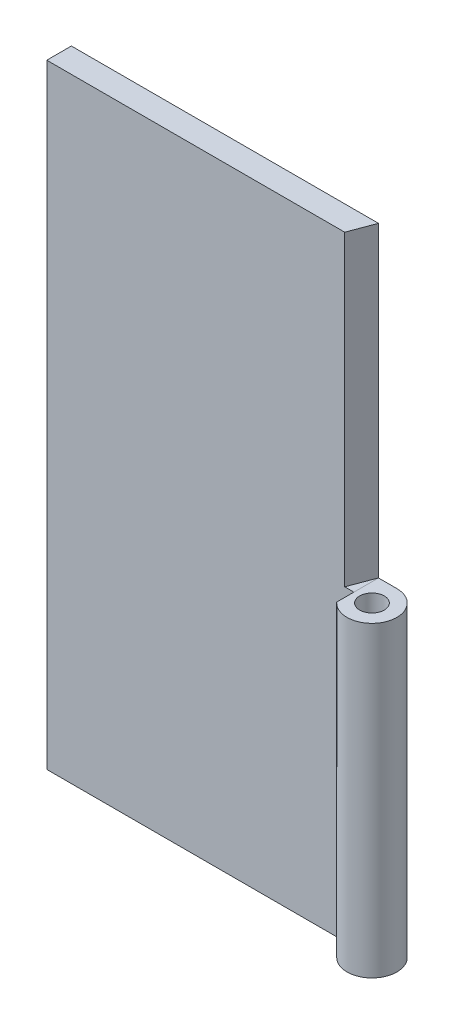
from build123d import *

# Parameters (mm, degrees)
SKETCH1_W           = 25
SKETCH1_H           = 50
BOSS_EXTRUDE1_DEPTH = 2
BOSS_EXTRUDE3_DEPTH = 25
SKETCH5_R           = 1
CUT_EXTRUDE2_DEPTH  = 58.710563854
CUT_EXTRUDE4_DEPTH  = 25


with BuildPart() as part:
    # Sketch1 → Boss-Extrude1 (new body)
    with BuildSketch(Plane.XY):
        with Locations((12.5, -25)):
            Rectangle(SKETCH1_W, SKETCH1_H)
    extrude(amount=BOSS_EXTRUDE1_DEPTH)

    # Sketch7 → Cut-Extrude4 (cut)
    with BuildSketch(Plane(origin=(0, 0, 0), x_dir=(1, 0, 0), z_dir=(0, 1, 0))):
        Polygon((25, 0), (24.25, -2), (25, -2), align=None)
    extrude(amount=-CUT_EXTRUDE4_DEPTH, mode=Mode.SUBTRACT)


with BuildPart() as body_2:
    # Sketch4 → Boss-Extrude3 (new body)
    with BuildSketch(Plane.XZ.offset(50)):
        with BuildLine():
            Line((25, 0), (26.5, 0))
            ThreePointArc((26.5, 0), (28.358090418, 2.850628125), (25, 3.4))
            Line((25, 3.4), (25, 0))
        make_face()
    extrude(amount=-BOSS_EXTRUDE3_DEPTH)

    # Sketch5 → Cut-Extrude2 (cut, through all)
    with BuildSketch(Plane.XZ.offset(50)):
        with Locations(Location((26.5, 2.030882353, 0), (0, 0, 270))):
            Circle(SKETCH5_R)
    extrude(amount=-CUT_EXTRUDE2_DEPTH, mode=Mode.SUBTRACT)


solid = Compound([part.part, body_2.part])
